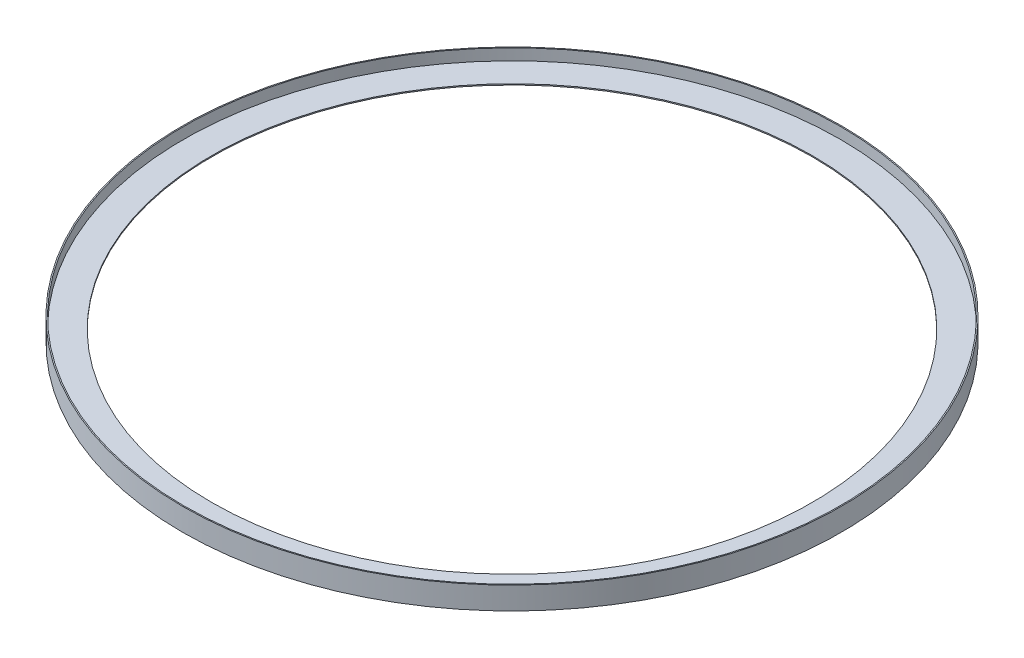
from build123d import *

# Parameters (mm, degrees)
SKETCH_1_R      = 292.5
SKETCH_1_R_2    = 267.5
EXTRUDE_1_DEPTH = 0.5
SKETCH_2_R      = 293.5
SKETCH_2_R_2    = 292.5
EXTRUDE_2_DEPTH = 10


with BuildPart() as part:
    # 草图1 → 凸台-拉伸1 (new, symmetric)
    with BuildSketch(Plane(origin=(0, 0, 0), x_dir=(1, 0, 0), z_dir=(0, 1, 0))):
        with Locations(Location((0, 0, 0), (0, 0, 270))):
            Circle(SKETCH_1_R)
        with Locations(Location((0, 0, 0), (0, 0, 270))):
            Circle(SKETCH_1_R_2, mode=Mode.SUBTRACT)
    extrude(amount=EXTRUDE_1_DEPTH, both=True)

    # 草图2 → 凸台-拉伸2 (add, symmetric)
    with BuildSketch(Plane(origin=(0, 0.5, 0), x_dir=(1, 0, 0), z_dir=(0, 1, 0))):
        with Locations(Location((0, 0, 0), (0, 0, 270))):
            Circle(SKETCH_2_R)
        with Locations(Location((0, 0, 0), (0, 0, 270))):
            Circle(SKETCH_2_R_2, mode=Mode.SUBTRACT)
    extrude(amount=EXTRUDE_2_DEPTH, both=True)


solid = part.part
